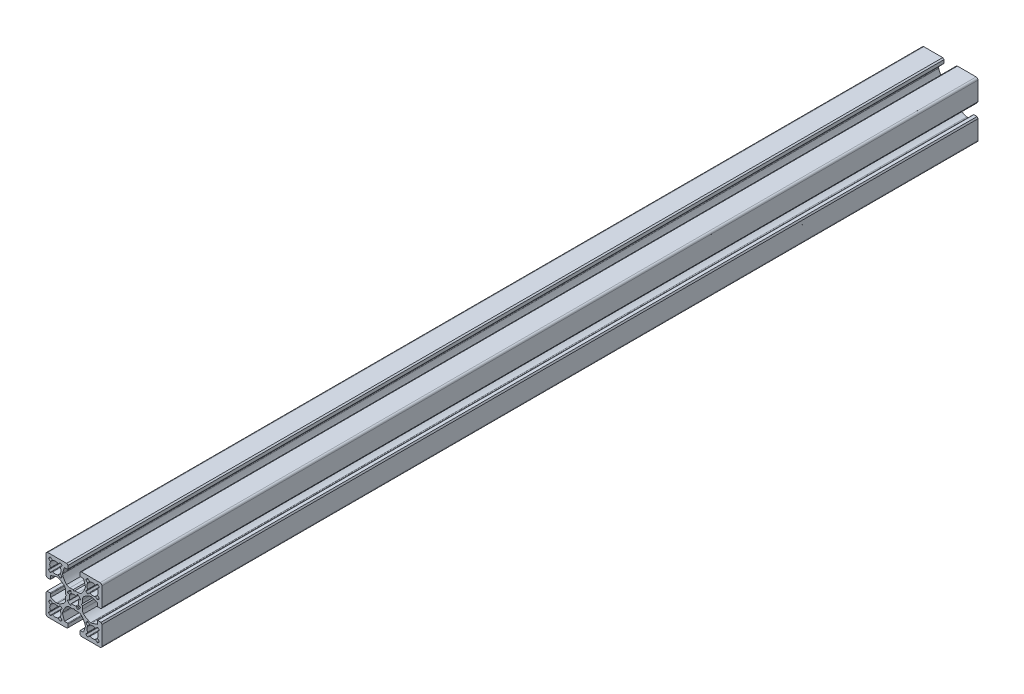
from build123d import *

# Parameters (mm, degrees)
EXTRUDE_1_DEPTH = 470


with BuildPart() as part:
    # Model → 보스-돌출1 (new body)
    with BuildSketch(Plane.XY):
        with BuildLine():
            Line((459.574175407, 182.783831091), (458.774175407, 183.283831091))
            Line((458.774175407, 183.283831091), (458.774175407, 184.983831091))
            ThreePointArc((458.774175407, 184.983831091), (458.862043373, 185.195963125), (459.074175407, 185.283831091))
            Line((459.074175407, 185.283831091), (460.724175407, 185.283831091))
            Line((460.724175407, 185.283831091), (461.711783237, 188.335604532))
            ThreePointArc((461.711783237, 188.335604532), (461.759141443, 188.594081667), (461.737530794, 188.855971354))
            ThreePointArc((461.737530794, 188.855971354), (460.898837663, 190.893750972), (459.628188183, 192.694140329))
            ThreePointArc((459.628188183, 192.694140329), (458.78251429, 193.132596412), (457.842016473, 193.283831091))
            Line((457.842016473, 193.283831091), (456.124175407, 193.283831091))
            Line((456.124175407, 193.283831091), (455.624175407, 193.783831091))
            Line((455.624175407, 193.783831091), (455.124175407, 193.283831091))
            Line((455.124175407, 193.283831091), (453.406334341, 193.283831091))
            ThreePointArc((453.406334341, 193.283831091), (452.465836525, 193.132596412), (451.620162632, 192.694140329))
            ThreePointArc((451.620162632, 192.694140329), (450.349513151, 190.893750972), (449.510820021, 188.855971354))
            ThreePointArc((449.510820021, 188.855971354), (449.489209372, 188.594081667), (449.536567578, 188.335604532))
            Line((449.536567578, 188.335604532), (450.524175407, 185.283831091))
            Line((450.524175407, 185.283831091), (452.174175407, 185.283831091))
            ThreePointArc((452.174175407, 185.283831091), (452.386307442, 185.195963125), (452.474175407, 184.983831091))
            Line((452.474175407, 184.983831091), (452.474175407, 183.283831091))
            Line((452.474175407, 183.283831091), (451.674175407, 182.783831091))
            Line((451.674175407, 182.783831091), (441.624175407, 182.783831091))
            ThreePointArc((441.624175407, 182.783831091), (440.917068626, 183.076724309), (440.624175407, 183.783831091))
            Line((440.624175407, 183.783831091), (440.624175407, 193.833831091))
            Line((440.624175407, 193.833831091), (441.124175407, 194.633831091))
            Line((441.124175407, 194.633831091), (442.824175407, 194.633831091))
            ThreePointArc((442.824175407, 194.633831091), (443.036307442, 194.545963125), (443.124175407, 194.333831091))
            Line((443.124175407, 194.333831091), (443.124175407, 192.683831091))
            Line((443.124175407, 192.683831091), (446.175948849, 191.696223261))
            ThreePointArc((446.175948849, 191.696223261), (446.434425983, 191.648865055), (446.696315671, 191.670475704))
            ThreePointArc((446.696315671, 191.670475704), (448.734095289, 192.509168835), (450.534484646, 193.779818315))
            ThreePointArc((450.534484646, 193.779818315), (450.972940729, 194.625492208), (451.124175407, 195.565990025))
            Line((451.124175407, 195.565990025), (451.124175407, 197.283831091))
            Line((451.124175407, 197.283831091), (451.624175407, 197.783831091))
            Line((451.624175407, 197.783831091), (451.124175407, 198.283831091))
            Line((451.124175407, 198.283831091), (451.124175407, 200.001672157))
            ThreePointArc((451.124175407, 200.001672157), (450.972940729, 200.942169973), (450.534484646, 201.787843866))
            ThreePointArc((450.534484646, 201.787843866), (448.734095289, 203.058493347), (446.696315671, 203.897186477))
            ThreePointArc((446.696315671, 203.897186477), (446.434425983, 203.918797126), (446.175948849, 203.87143892))
            Line((446.175948849, 203.87143892), (443.124175407, 202.883831091))
            Line((443.124175407, 202.883831091), (443.124175407, 201.233831091))
            ThreePointArc((443.124175407, 201.233831091), (443.036307442, 201.021699056), (442.824175407, 200.933831091))
            Line((442.824175407, 200.933831091), (441.124175407, 200.933831091))
            Line((441.124175407, 200.933831091), (440.624175407, 201.733831091))
            Line((440.624175407, 201.733831091), (440.624175407, 211.783831091))
            ThreePointArc((440.624175407, 211.783831091), (440.917068626, 212.490937872), (441.624175407, 212.783831091))
            Line((441.624175407, 212.783831091), (451.674175407, 212.783831091))
            Line((451.674175407, 212.783831091), (452.474175407, 212.283831091))
            Line((452.474175407, 212.283831091), (452.474175407, 210.583831091))
            ThreePointArc((452.474175407, 210.583831091), (452.386307442, 210.371699056), (452.174175407, 210.283831091))
            Line((452.174175407, 210.283831091), (450.524175407, 210.283831091))
            Line((450.524175407, 210.283831091), (449.536567578, 207.232057649))
            ThreePointArc((449.536567578, 207.232057649), (449.489209372, 206.973580515), (449.510820021, 206.711690827))
            ThreePointArc((449.510820021, 206.711690827), (450.349513151, 204.673911209), (451.620162632, 202.873521852))
            ThreePointArc((451.620162632, 202.873521852), (452.465836525, 202.435065769), (453.406334341, 202.283831091))
            Line((453.406334341, 202.283831091), (455.124175407, 202.283831091))
            Line((455.124175407, 202.283831091), (455.624175407, 201.783831091))
            Line((455.624175407, 201.783831091), (456.124175407, 202.283831091))
            Line((456.124175407, 202.283831091), (457.842016473, 202.283831091))
            ThreePointArc((457.842016473, 202.283831091), (458.78251429, 202.435065769), (459.628188183, 202.873521852))
            ThreePointArc((459.628188183, 202.873521852), (460.898837663, 204.673911209), (461.737530794, 206.711690827))
            ThreePointArc((461.737530794, 206.711690827), (461.759141443, 206.973580515), (461.711783237, 207.232057649))
            Line((461.711783237, 207.232057649), (460.724175407, 210.283831091))
            Line((460.724175407, 210.283831091), (459.074175407, 210.283831091))
            ThreePointArc((459.074175407, 210.283831091), (458.862043373, 210.371699056), (458.774175407, 210.583831091))
            Line((458.774175407, 210.583831091), (458.774175407, 212.283831091))
            Line((458.774175407, 212.283831091), (459.574175407, 212.783831091))
            Line((459.574175407, 212.783831091), (469.624175407, 212.783831091))
            ThreePointArc((469.624175407, 212.783831091), (470.331282189, 212.490937872), (470.624175407, 211.783831091))
            Line((470.624175407, 211.783831091), (470.624175407, 201.733831091))
            Line((470.624175407, 201.733831091), (470.124175407, 200.933831091))
            Line((470.124175407, 200.933831091), (468.424175407, 200.933831091))
            ThreePointArc((468.424175407, 200.933831091), (468.212043373, 201.021699056), (468.124175407, 201.233831091))
            Line((468.124175407, 201.233831091), (468.124175407, 202.883831091))
            Line((468.124175407, 202.883831091), (465.072401966, 203.87143892))
            ThreePointArc((465.072401966, 203.87143892), (464.813924831, 203.918797126), (464.552035144, 203.897186477))
            ThreePointArc((464.552035144, 203.897186477), (462.514255526, 203.058493347), (460.713866169, 201.787843866))
            ThreePointArc((460.713866169, 201.787843866), (460.275410086, 200.942169973), (460.124175407, 200.001672157))
            Line((460.124175407, 200.001672157), (460.124175407, 198.283831091))
            Line((460.124175407, 198.283831091), (459.624175407, 197.783831091))
            Line((459.624175407, 197.783831091), (460.124175407, 197.283831091))
            Line((460.124175407, 197.283831091), (460.124175407, 195.565990025))
            ThreePointArc((460.124175407, 195.565990025), (460.275410086, 194.625492208), (460.713866169, 193.779818315))
            ThreePointArc((460.713866169, 193.779818315), (462.514255526, 192.509168835), (464.552035144, 191.670475704))
            ThreePointArc((464.552035144, 191.670475704), (464.813924831, 191.648865055), (465.072401966, 191.696223261))
            Line((465.072401966, 191.696223261), (468.124175407, 192.683831091))
            Line((468.124175407, 192.683831091), (468.124175407, 194.333831091))
            ThreePointArc((468.124175407, 194.333831091), (468.212043373, 194.545963125), (468.424175407, 194.633831091))
            Line((468.424175407, 194.633831091), (470.124175407, 194.633831091))
            Line((470.124175407, 194.633831091), (470.624175407, 193.833831091))
            Line((470.624175407, 193.833831091), (470.624175407, 183.783831091))
            ThreePointArc((470.624175407, 183.783831091), (470.331282189, 183.076724309), (469.624175407, 182.783831091))
            Line((469.624175407, 182.783831091), (459.574175407, 182.783831091))
        make_face()
        with BuildLine():
            Line((462.879323242, 206.101978996), (462.138752469, 205.361408224))
            ThreePointArc((462.138752469, 205.361408224), (462.051316542, 205.165370796), (462.117245146, 204.961093696))
            ThreePointArc((462.117245146, 204.961093696), (462.439854993, 204.601850575), (462.799098114, 204.279240729))
            ThreePointArc((462.799098114, 204.279240729), (463.003375214, 204.213312125), (463.199412641, 204.300748052))
            Line((463.199412641, 204.300748052), (463.939983413, 205.041318824))
            ThreePointArc((463.939983413, 205.041318824), (464.103755722, 205.125263363), (464.285726362, 205.097790817))
            ThreePointArc((464.285726362, 205.097790817), (465.621835508, 204.783831091), (466.957944654, 205.097790817))
            ThreePointArc((466.957944654, 205.097790817), (467.139915294, 205.125263363), (467.303687603, 205.041318824))
            Line((467.303687603, 205.041318824), (468.044258375, 204.300748052))
            ThreePointArc((468.044258375, 204.300748052), (468.240295802, 204.213312125), (468.444572902, 204.279240729))
            ThreePointArc((468.444572902, 204.279240729), (468.803816023, 204.601850575), (469.12642587, 204.961093696))
            ThreePointArc((469.12642587, 204.961093696), (469.192354474, 205.165370796), (469.104918547, 205.361408224))
            Line((469.104918547, 205.361408224), (468.364347775, 206.101978996))
            ThreePointArc((468.364347775, 206.101978996), (468.280403236, 206.265751305), (468.307875782, 206.447721945))
            ThreePointArc((468.307875782, 206.447721945), (468.621835508, 207.783831091), (468.307875782, 209.119940236))
            ThreePointArc((468.307875782, 209.119940236), (468.280403236, 209.301910877), (468.364347774, 209.465683185))
            Line((468.364347774, 209.465683185), (469.104918547, 210.206253957))
            ThreePointArc((469.104918547, 210.206253957), (469.192354474, 210.402291385), (469.12642587, 210.606568485))
            ThreePointArc((469.12642587, 210.606568485), (468.803816023, 210.965811606), (468.444572902, 211.288421452))
            ThreePointArc((468.444572902, 211.288421452), (468.240295802, 211.354350057), (468.044258375, 211.266914129))
            Line((468.044258375, 211.266914129), (467.303687603, 210.526343357))
            ThreePointArc((467.303687603, 210.526343357), (467.139915294, 210.442398819), (466.957944654, 210.469871364))
            ThreePointArc((466.957944654, 210.469871364), (465.621835508, 210.783831091), (464.285726362, 210.469871364))
            ThreePointArc((464.285726362, 210.469871364), (464.103755722, 210.442398819), (463.939983413, 210.526343357))
            Line((463.939983413, 210.526343357), (463.199412641, 211.266914129))
            ThreePointArc((463.199412641, 211.266914129), (463.003375214, 211.354350057), (462.799098114, 211.288421452))
            ThreePointArc((462.799098114, 211.288421452), (462.439854993, 210.965811606), (462.117245146, 210.606568485))
            ThreePointArc((462.117245146, 210.606568485), (462.051316542, 210.402291385), (462.138752469, 210.206253957))
            Line((462.138752469, 210.206253957), (462.879323242, 209.465683185))
            ThreePointArc((462.879323242, 209.465683185), (462.96326778, 209.301910877), (462.935795235, 209.119940236))
            ThreePointArc((462.935795235, 209.119940236), (462.621835508, 207.783831091), (462.935795235, 206.447721945))
            ThreePointArc((462.935795235, 206.447721945), (462.96326778, 206.265751305), (462.879323242, 206.101978996))
        make_face(mode=Mode.SUBTRACT)
        with BuildLine():
            Line((462.878674407, 189.465117129), (462.138161401, 190.205745663))
            ThreePointArc((462.138161401, 190.205745663), (462.050740765, 190.40178991), (462.116685302, 190.606061867))
            ThreePointArc((462.116685302, 190.606061867), (462.439323169, 190.965279823), (462.798591452, 191.287861648))
            ThreePointArc((462.798591452, 191.287861648), (463.002873694, 191.353774318), (463.198904301, 191.2663231))
            Line((463.198904301, 191.2663231), (463.939417306, 190.525694566))
            ThreePointArc((463.939417306, 190.525694566), (464.103183067, 190.441737254), (464.285155849, 190.469195606))
            ThreePointArc((464.285155849, 190.469195606), (465.62128948, 190.783051115), (466.957374133, 190.468987173))
            ThreePointArc((466.957374133, 190.468987173), (467.13934263, 190.441500434), (467.303121485, 190.525432198))
            Line((467.303121485, 190.525432198), (468.04375002, 191.265945204))
            ThreePointArc((468.04375002, 191.265945204), (468.239794266, 191.35336584), (468.444066223, 191.287421303))
            ThreePointArc((468.444066223, 191.287421303), (468.80328418, 190.964783436), (469.125866004, 190.605515153))
            ThreePointArc((469.125866004, 190.605515153), (469.191778675, 190.401232911), (469.104327457, 190.205202304))
            Line((469.104327457, 190.205202304), (468.363698923, 189.464689299))
            ThreePointArc((468.363698923, 189.464689299), (468.27974161, 189.300923538), (468.307199962, 189.118950756))
            ThreePointArc((468.307199962, 189.118950756), (468.621055472, 187.782817125), (468.30699153, 186.446732472))
            ThreePointArc((468.30699153, 186.446732472), (468.279504791, 186.264763975), (468.363436555, 186.100985119))
            Line((468.363436555, 186.100985119), (469.103949561, 185.360356585))
            ThreePointArc((469.103949561, 185.360356585), (469.191370197, 185.164312338), (469.125425659, 184.960040382))
            ThreePointArc((469.125425659, 184.960040382), (468.802787793, 184.600822425), (468.443519509, 184.2782406))
            ThreePointArc((468.443519509, 184.2782406), (468.239237268, 184.21232793), (468.043206661, 184.299779148))
            Line((468.043206661, 184.299779148), (467.302693655, 185.040407682))
            ThreePointArc((467.302693655, 185.040407682), (467.138927895, 185.124364994), (466.956955112, 185.096906643))
            ThreePointArc((466.956955112, 185.096906643), (465.620821482, 184.783051133), (464.284736829, 185.097115075))
            ThreePointArc((464.284736829, 185.097115075), (464.102768332, 185.124601814), (463.938989476, 185.04067005))
            Line((463.938989476, 185.04067005), (463.198360942, 184.300157044))
            ThreePointArc((463.198360942, 184.300157044), (463.002316695, 184.212736408), (462.798044738, 184.278680946))
            ThreePointArc((462.798044738, 184.278680946), (462.438826782, 184.601318812), (462.116244957, 184.960587096))
            ThreePointArc((462.116244957, 184.960587096), (462.050332287, 185.164869337), (462.137783504, 185.360899944))
            Line((462.137783504, 185.360899944), (462.878412039, 186.10141295))
            ThreePointArc((462.878412039, 186.10141295), (462.962369351, 186.26517871), (462.934910999, 186.447151493))
            ThreePointArc((462.934910999, 186.447151493), (462.62105549, 187.783285123), (462.935119432, 189.119369776))
            ThreePointArc((462.935119432, 189.119369776), (462.962606171, 189.301338273), (462.878674407, 189.465117129))
        make_face(mode=Mode.SUBTRACT)
        with BuildLine():
            Line((448.367336509, 189.465117129), (449.107849514, 190.205745663))
            ThreePointArc((449.107849514, 190.205745663), (449.195270151, 190.40178991), (449.129325613, 190.606061867))
            ThreePointArc((449.129325613, 190.606061867), (448.806687747, 190.965279823), (448.447419463, 191.287861648))
            ThreePointArc((448.447419463, 191.287861648), (448.243137222, 191.353774318), (448.047106615, 191.2663231))
            Line((448.047106615, 191.2663231), (447.306593609, 190.525694566))
            ThreePointArc((447.306593609, 190.525694566), (447.142827848, 190.441737254), (446.960855066, 190.469195606))
            ThreePointArc((446.960855066, 190.469195606), (445.624721436, 190.783051115), (444.288636783, 190.468987173))
            ThreePointArc((444.288636783, 190.468987173), (444.106668286, 190.441500434), (443.94288943, 190.525432198))
            Line((443.94288943, 190.525432198), (443.202260896, 191.265945204))
            ThreePointArc((443.202260896, 191.265945204), (443.006216649, 191.35336584), (442.801944692, 191.287421303))
            ThreePointArc((442.801944692, 191.287421303), (442.442726735, 190.964783436), (442.120144911, 190.605515153))
            ThreePointArc((442.120144911, 190.605515153), (442.054232241, 190.401232911), (442.141683458, 190.205202304))
            Line((442.141683458, 190.205202304), (442.882311993, 189.464689299))
            ThreePointArc((442.882311993, 189.464689299), (442.966269305, 189.300923538), (442.938810953, 189.118950756))
            ThreePointArc((442.938810953, 189.118950756), (442.624955444, 187.782817125), (442.939019385, 186.446732472))
            ThreePointArc((442.939019385, 186.446732472), (442.966506124, 186.264763975), (442.88257436, 186.100985119))
            Line((442.88257436, 186.100985119), (442.142061355, 185.360356585))
            ThreePointArc((442.142061355, 185.360356585), (442.054640719, 185.164312338), (442.120585256, 184.960040382))
            ThreePointArc((442.120585256, 184.960040382), (442.443223122, 184.600822425), (442.802491406, 184.2782406))
            ThreePointArc((442.802491406, 184.2782406), (443.006773648, 184.21232793), (443.202804255, 184.299779148))
            Line((443.202804255, 184.299779148), (443.94331726, 185.040407682))
            ThreePointArc((443.94331726, 185.040407682), (444.107083021, 185.124364994), (444.289055803, 185.096906643))
            ThreePointArc((444.289055803, 185.096906643), (445.625189434, 184.783051133), (446.961274087, 185.097115075))
            ThreePointArc((446.961274087, 185.097115075), (447.143242583, 185.124601814), (447.307021439, 185.04067005))
            Line((447.307021439, 185.04067005), (448.047649974, 184.300157044))
            ThreePointArc((448.047649974, 184.300157044), (448.24369422, 184.212736408), (448.447966177, 184.278680946))
            ThreePointArc((448.447966177, 184.278680946), (448.807184134, 184.601318812), (449.129765958, 184.960587096))
            ThreePointArc((449.129765958, 184.960587096), (449.195678629, 185.164869337), (449.108227411, 185.360899944))
            Line((449.108227411, 185.360899944), (448.367598877, 186.10141295))
            ThreePointArc((448.367598877, 186.10141295), (448.283641564, 186.26517871), (448.311099916, 186.447151493))
            ThreePointArc((448.311099916, 186.447151493), (448.624955426, 187.783285123), (448.310891484, 189.119369776))
            ThreePointArc((448.310891484, 189.119369776), (448.283404745, 189.301338273), (448.367336509, 189.465117129))
        make_face(mode=Mode.SUBTRACT)
        with BuildLine():
            Line((457.210300672, 201.021172973), (457.076729929, 200.280239327))
            ThreePointArc((457.076729929, 200.280239327), (456.920864875, 200.06780508), (456.657491136, 200.060288559))
            ThreePointArc((456.657491136, 200.060288559), (455.624175407, 200.283831091), (454.590859679, 200.060288559))
            ThreePointArc((454.590859679, 200.060288559), (454.32748594, 200.06780508), (454.171620886, 200.280239327))
            Line((454.171620886, 200.280239327), (454.038050143, 201.021172973))
            ThreePointArc((454.038050143, 201.021172973), (453.867687152, 201.240722573), (453.590171174, 201.226215416))
            ThreePointArc((453.590171174, 201.226215416), (452.796918232, 200.611088266), (452.181791082, 199.817835324))
            ThreePointArc((452.181791082, 199.817835324), (452.167283925, 199.540319346), (452.386833525, 199.369956355))
            Line((452.386833525, 199.369956355), (453.127767171, 199.236385612))
            ThreePointArc((453.127767171, 199.236385612), (453.340201418, 199.080520558), (453.347717939, 198.817146819))
            ThreePointArc((453.347717939, 198.817146819), (453.124175407, 197.783831091), (453.347717939, 196.750515362))
            ThreePointArc((453.347717939, 196.750515362), (453.340201418, 196.487141623), (453.127767171, 196.331276569))
            Line((453.127767171, 196.331276569), (452.386833525, 196.197705826))
            ThreePointArc((452.386833525, 196.197705826), (452.167283925, 196.027342835), (452.181791082, 195.749826857))
            ThreePointArc((452.181791082, 195.749826857), (452.796918232, 194.956573915), (453.590171174, 194.341446765))
            ThreePointArc((453.590171174, 194.341446765), (453.867687152, 194.326939608), (454.038050143, 194.546489208))
            Line((454.038050143, 194.546489208), (454.171620886, 195.287422854))
            ThreePointArc((454.171620886, 195.287422854), (454.32748594, 195.499857101), (454.590859679, 195.507373622))
            ThreePointArc((454.590859679, 195.507373622), (455.624175407, 195.283831091), (456.657491136, 195.507373622))
            ThreePointArc((456.657491136, 195.507373622), (456.920864875, 195.499857101), (457.076729929, 195.287422854))
            Line((457.076729929, 195.287422854), (457.210300672, 194.546489208))
            ThreePointArc((457.210300672, 194.546489208), (457.380663663, 194.326939608), (457.658179641, 194.341446765))
            ThreePointArc((457.658179641, 194.341446765), (458.451432582, 194.956573915), (459.066559733, 195.749826857))
            ThreePointArc((459.066559733, 195.749826857), (459.08106689, 196.027342835), (458.86151729, 196.197705826))
            Line((458.86151729, 196.197705826), (458.120583644, 196.331276569))
            ThreePointArc((458.120583644, 196.331276569), (457.908149397, 196.487141623), (457.900632876, 196.750515362))
            ThreePointArc((457.900632876, 196.750515362), (458.124175407, 197.783831091), (457.900632876, 198.817146819))
            ThreePointArc((457.900632876, 198.817146819), (457.908149397, 199.080520558), (458.120583644, 199.236385612))
            Line((458.120583644, 199.236385612), (458.86151729, 199.369956355))
            ThreePointArc((458.86151729, 199.369956355), (459.08106689, 199.540319346), (459.066559733, 199.817835324))
            ThreePointArc((459.066559733, 199.817835324), (458.451432582, 200.611088266), (457.658179641, 201.226215416))
            ThreePointArc((457.658179641, 201.226215416), (457.380663663, 201.240722573), (457.210300672, 201.021172973))
        make_face(mode=Mode.SUBTRACT)
        with BuildLine():
            Line((448.366687674, 206.101978996), (449.107258446, 205.361408224))
            ThreePointArc((449.107258446, 205.361408224), (449.194694373, 205.165370796), (449.128765769, 204.961093696))
            ThreePointArc((449.128765769, 204.961093696), (448.806155923, 204.601850575), (448.446912802, 204.279240729))
            ThreePointArc((448.446912802, 204.279240729), (448.242635702, 204.213312125), (448.046598274, 204.300748052))
            Line((448.046598274, 204.300748052), (447.306027502, 205.041318824))
            ThreePointArc((447.306027502, 205.041318824), (447.142255193, 205.125263363), (446.960284553, 205.097790817))
            ThreePointArc((446.960284553, 205.097790817), (445.624175407, 204.783831091), (444.288066262, 205.097790817))
            ThreePointArc((444.288066262, 205.097790817), (444.106095621, 205.125263363), (443.942323313, 205.041318824))
            Line((443.942323313, 205.041318824), (443.20175254, 204.300748052))
            ThreePointArc((443.20175254, 204.300748052), (443.005715113, 204.213312125), (442.801438013, 204.279240729))
            ThreePointArc((442.801438013, 204.279240729), (442.442194892, 204.601850575), (442.119585046, 204.961093696))
            ThreePointArc((442.119585046, 204.961093696), (442.053656441, 205.165370796), (442.141092369, 205.361408224))
            Line((442.141092369, 205.361408224), (442.881663141, 206.101978996))
            ThreePointArc((442.881663141, 206.101978996), (442.965607679, 206.265751305), (442.938135134, 206.447721945))
            ThreePointArc((442.938135134, 206.447721945), (442.624175407, 207.783831091), (442.938135134, 209.119940236))
            ThreePointArc((442.938135134, 209.119940236), (442.965607679, 209.301910877), (442.881663141, 209.465683185))
            Line((442.881663141, 209.465683185), (442.141092369, 210.206253957))
            ThreePointArc((442.141092369, 210.206253957), (442.053656441, 210.402291385), (442.119585046, 210.606568485))
            ThreePointArc((442.119585046, 210.606568485), (442.442194892, 210.965811606), (442.801438013, 211.288421452))
            ThreePointArc((442.801438013, 211.288421452), (443.005715113, 211.354350057), (443.20175254, 211.266914129))
            Line((443.20175254, 211.266914129), (443.942323313, 210.526343357))
            ThreePointArc((443.942323313, 210.526343357), (444.106095621, 210.442398819), (444.288066262, 210.469871364))
            ThreePointArc((444.288066262, 210.469871364), (445.624175407, 210.783831091), (446.960284553, 210.469871364))
            ThreePointArc((446.960284553, 210.469871364), (447.142255193, 210.442398819), (447.306027502, 210.526343357))
            Line((447.306027502, 210.526343357), (448.046598274, 211.266914129))
            ThreePointArc((448.046598274, 211.266914129), (448.242635702, 211.354350056), (448.446912802, 211.288421452))
            ThreePointArc((448.446912802, 211.288421452), (448.806155923, 210.965811606), (449.128765769, 210.606568485))
            ThreePointArc((449.128765769, 210.606568485), (449.194694373, 210.402291385), (449.107258446, 210.206253957))
            Line((449.107258446, 210.206253957), (448.366687674, 209.465683185))
            ThreePointArc((448.366687674, 209.465683185), (448.282743135, 209.301910877), (448.310215681, 209.119940236))
            ThreePointArc((448.310215681, 209.119940236), (448.624175407, 207.783831091), (448.310215681, 206.447721945))
            ThreePointArc((448.310215681, 206.447721945), (448.282743135, 206.265751305), (448.366687674, 206.101978996))
        make_face(mode=Mode.SUBTRACT)
    extrude(amount=EXTRUDE_1_DEPTH)


solid = part.part
